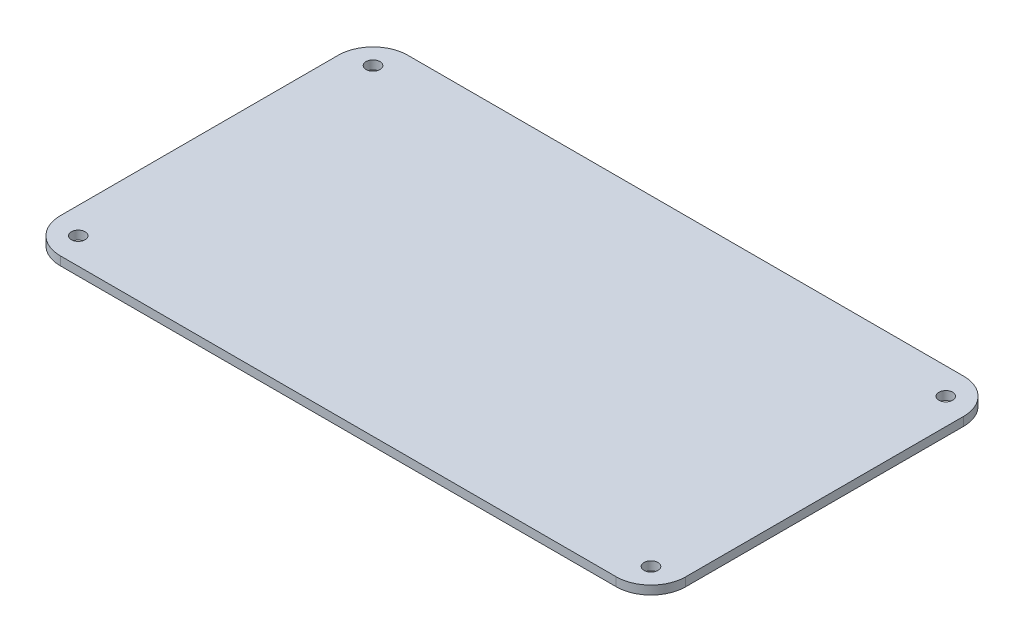
from build123d import *

# Parameters (mm, degrees)
SKETCH1_R           = 2.54
BOSS_EXTRUDE2_DEPTH = 3.175


with BuildPart() as part:
    # Sketch1 → Boss-Extrude2 (new body)
    with BuildSketch(Plane(origin=(0, 0, 0), x_dir=(1, 0, 0), z_dir=(0, 1, 0))):
        with BuildLine():
            Line((101.6, -63.5), (-101.6, -63.5))
            ThreePointArc((-101.6, -63.5), (-110.580256121, -59.780256121), (-114.3, -50.8))
            Line((-114.3, -50.8), (-114.3, 50.8))
            ThreePointArc((-114.3, 50.8), (-110.580256121, 59.780256121), (-101.6, 63.5))
            Line((-101.6, 63.5), (101.6, 63.5))
            ThreePointArc((101.6, 63.5), (110.580256121, 59.780256121), (114.3, 50.8))
            Line((114.3, 50.8), (114.3, -50.8))
            ThreePointArc((114.3, -50.8), (110.580256121, -59.780256121), (101.6, -63.5))
        make_face()
        with Locations(Location((-104.6734, 53.8734, 0), (0, 0, 270))):
            Circle(SKETCH1_R, mode=Mode.SUBTRACT)
        with Locations(Location((104.6734, 53.8734, 0), (0, 0, 90))):
            Circle(SKETCH1_R, mode=Mode.SUBTRACT)
        with Locations(Location((104.6734, -53.8734, 0), (0, 0, 270))):
            Circle(SKETCH1_R, mode=Mode.SUBTRACT)
        with Locations(Location((-104.6734, -53.8734, 0), (0, 0, 90))):
            Circle(SKETCH1_R, mode=Mode.SUBTRACT)
    extrude(amount=BOSS_EXTRUDE2_DEPTH)


solid = part.part
